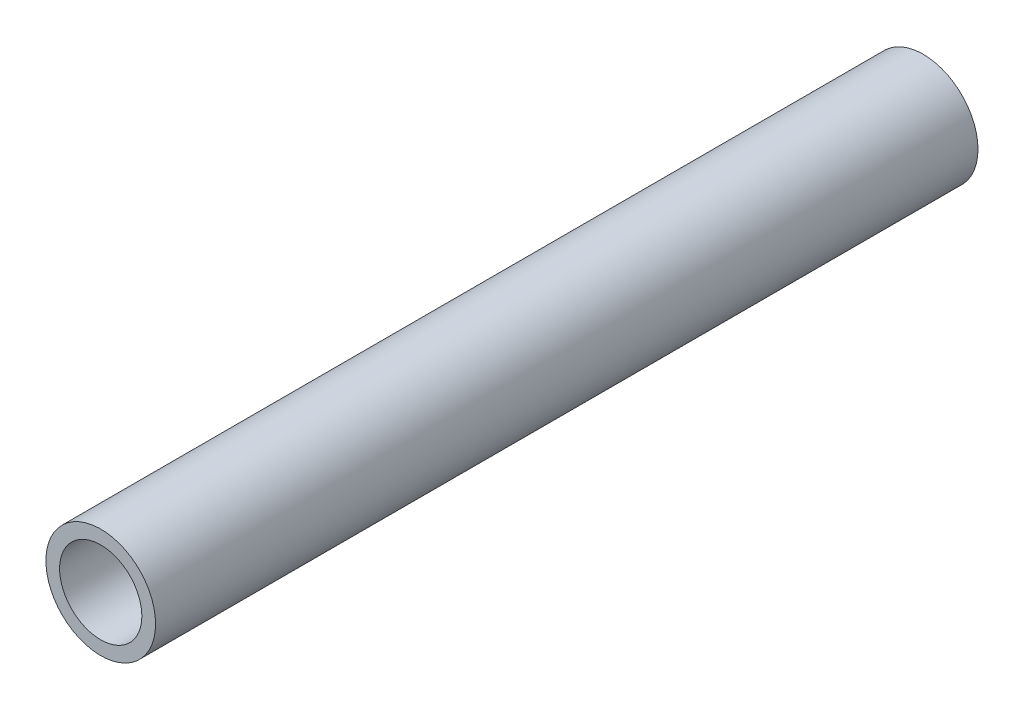
from build123d import *

# Parameters (mm, degrees)
ESQUISSE1_R             = 4
BOSS_EXTRU_1_DEPTH      = 60
ESQUISSE2_R             = 3
ENL_V_MAT_EXTRU_1_DEPTH = 5


with BuildPart() as part:
    # Esquisse1 → Boss.-Extru.1 (new body)
    with BuildSketch(Plane.XY):
        Circle(ESQUISSE1_R)
    extrude(amount=BOSS_EXTRU_1_DEPTH)

    # Esquisse2 → Enlèv. mat.-Extru.1 (cut)
    with BuildSketch(Plane.XY.offset(60)):
        Circle(ESQUISSE2_R)
    extrude(amount=-ENL_V_MAT_EXTRU_1_DEPTH, mode=Mode.SUBTRACT)


solid = part.part
